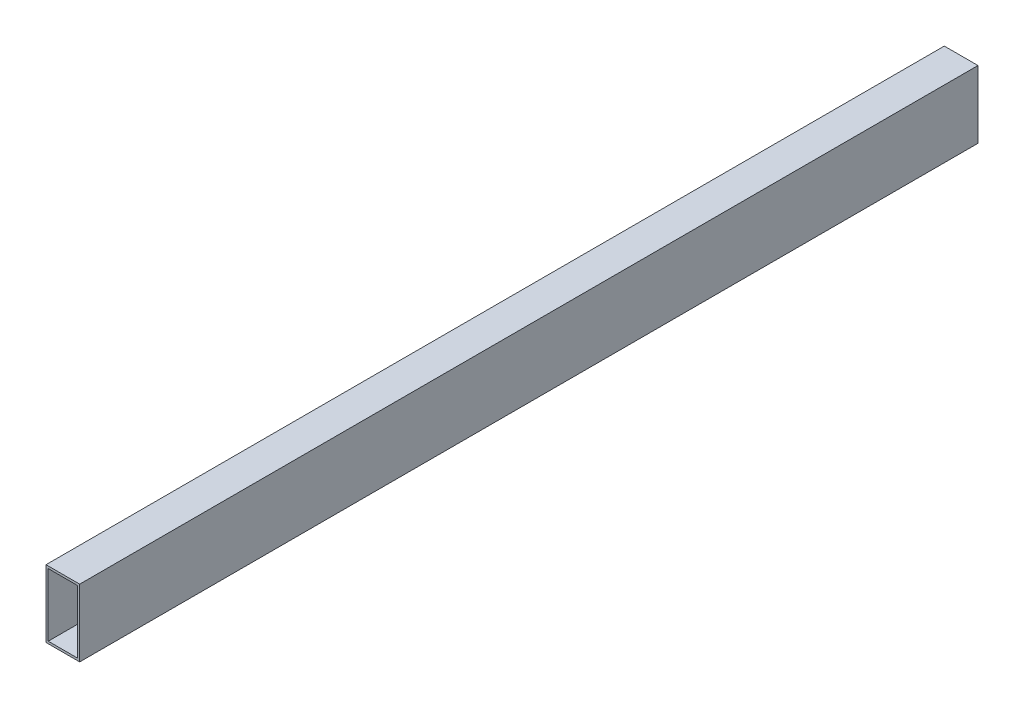
from build123d import *

# Parameters (mm, degrees)
SKETCH_1_W      = 30
SKETCH_1_H      = 60
SKETCH_1_W_2    = 26
SKETCH_1_H_2    = 56
EXTRUDE_1_DEPTH = 800


with BuildPart() as part:
    # Эскиз1 → Бобышка-Вытянуть1 (new body)
    with BuildSketch(Plane.XY):
        with Locations((-33.555321079, 3.789530779)):
            Rectangle(SKETCH_1_W, SKETCH_1_H)
        with Locations((-33.555321079, 3.789530779)):
            Rectangle(SKETCH_1_W_2, SKETCH_1_H_2, mode=Mode.SUBTRACT)
    extrude(amount=EXTRUDE_1_DEPTH)


solid = part.part
